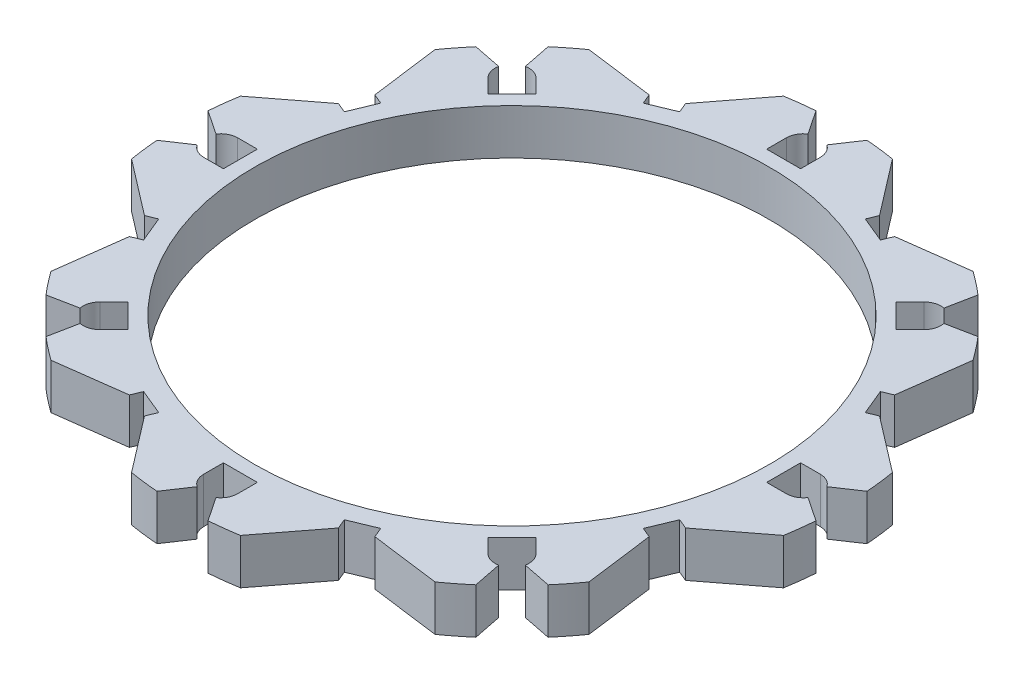
from build123d import *

# Parameters (mm, degrees)
SKETCH1_R           = 54.55
BOSS_EXTRUDE1_DEPTH = 7.5
SKETCH2_R           = 42.5
CUT_EXTRUDE1_DEPTH  = 78.509063986
CUT_EXTRUDE2_DEPTH  = 78.509063986
CUT_EXTRUDE6_DEPTH  = 78.509063986
CIRPATTERN1_COUNT   = 8
CIRPATTERN2_COUNT   = 8


with BuildPart() as part:
    # Sketch1 → Boss-Extrude1 (new body)
    with BuildSketch(Plane(origin=(0, 0, 0), x_dir=(1, 0, 0), z_dir=(0, 1, 0))):
        Circle(SKETCH1_R)
    extrude(amount=BOSS_EXTRUDE1_DEPTH)

    # Sketch2 → Cut-Extrude1 (cut, through all)
    with BuildSketch(Plane(origin=(0, 7.5, 0), x_dir=(1, 0, 0), z_dir=(0, 1, 0))):
        Circle(SKETCH2_R)
    extrude(amount=-CUT_EXTRUDE1_DEPTH, mode=Mode.SUBTRACT)

    # Sketch3 → Cut-Extrude2 (cut, through all)
    with BuildSketch(Plane(origin=(0, 7.5, 0), x_dir=(1, 0, 0), z_dir=(0, 1, 0))):
        with BuildLine():
            Line((-2.8, -48.082), (-2.8, -44.832))
            Line((-2.8, -44.832), (2.8, -44.832))
            Line((2.8, -44.832), (2.8, -48.082))
            ThreePointArc((2.8, -48.082), (2.46937954, -49.401910863), (1.555596652, -50.410114914))
            Line((1.555596652, -50.410114914), (4.212915889, -54.387074197))
            ThreePointArc((4.212915889, -54.387074197), (0, -54.55), (-4.212915889, -54.387074197))
            Line((-4.212915889, -54.387074197), (-1.555596652, -50.410114914))
            ThreePointArc((-1.555596652, -50.410114914), (-2.46937954, -49.401910863), (-2.8, -48.082))
        make_face()
    cut_extrude2 = extrude(amount=-CUT_EXTRUDE2_DEPTH, mode=Mode.SUBTRACT)

    # Sketch9 → Cut-Extrude6 (cut, through all)
    with BuildSketch(Plane(origin=(0, 7.5, 0), x_dir=(1, 0, 0), z_dir=(0, 1, 0))):
        with BuildLine():
            Line((-20.257229317, -42.895088115), (-31.690865911, -44.400354929))
            ThreePointArc((-31.690865911, -44.400354929), (-20.875381236, -50.397628498), (-8.98696587, -53.804618245))
            Line((-8.98696587, -53.804618245), (-16.007383468, -44.655431904))
            Line((-16.007383468, -44.655431904), (-15.318553289, -42.992448745))
            Line((-15.318553289, -42.992448745), (-19.568399139, -41.232104956))
            Line((-19.568399139, -41.232104956), (-20.257229317, -42.895088115))
        make_face()
    cut_extrude6 = extrude(amount=-CUT_EXTRUDE6_DEPTH, mode=Mode.SUBTRACT)

    # CirPattern1: Cut-Extrude2 ×8 about axis
    cirpattern1_axis = Axis((0, 10.872185225, 0), (0, -1, 0))
    for i in range(1, CIRPATTERN1_COUNT):
        add(cut_extrude2.rotate(cirpattern1_axis, i * 360 / CIRPATTERN1_COUNT), mode=Mode.SUBTRACT)

    # CirPattern2: Cut-Extrude6 ×8 about axis
    cirpattern2_axis = Axis((0, 10.872185225, 0), (0, -1, 0))
    for i in range(1, CIRPATTERN2_COUNT):
        add(cut_extrude6.rotate(cirpattern2_axis, i * 360 / CIRPATTERN2_COUNT), mode=Mode.SUBTRACT)


solid = part.part
